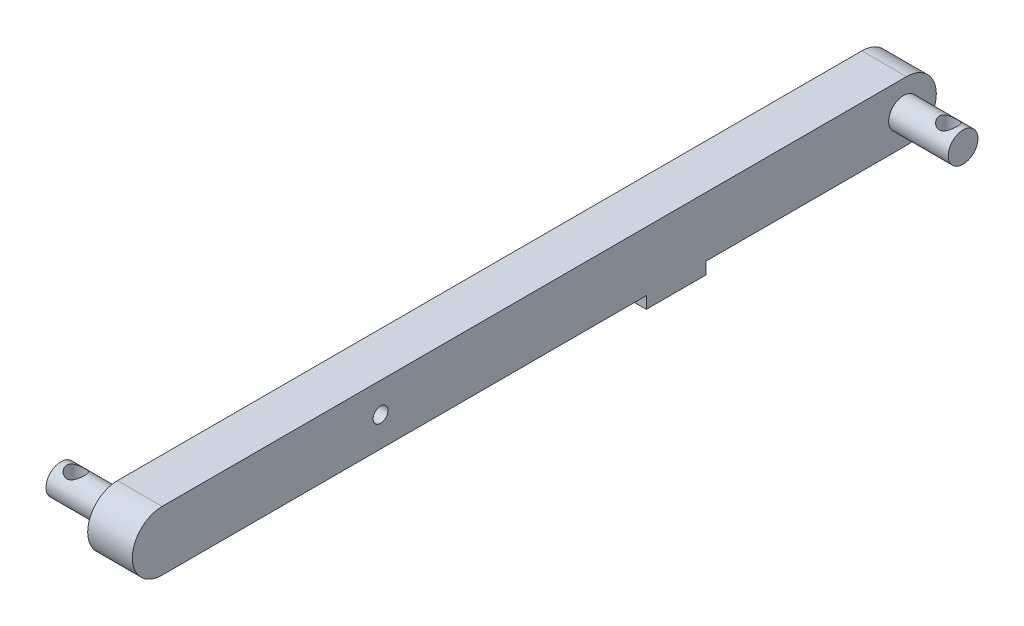
from build123d import *

# Parameters (mm, degrees)
BOSS_EXTRUDE1_DEPTH = 9.525
SKETCH4_R           = 6.35
BOSS_EXTRUDE2_DEPTH = 25.4
SKETCH5_R           = 6.35
BOSS_EXTRUDE3_DEPTH = 25.4
SKETCH6_R           = 3.175
CUT_EXTRUDE1_DEPTH  = 19.05
SKETCH7_W           = 19.05
SKETCH7_H           = 25.4
BOSS_EXTRUDE4_DEPTH = 5.08
SKETCH8_R           = 3.81
CUT_EXTRUDE2_DEPTH  = 6.35


with BuildPart() as part:
    # Sketch2 → Boss-Extrude1 (new, symmetric)
    with BuildSketch(Plane(origin=(0, 0, 0), x_dir=(0, 0, -1), z_dir=(1, 0, 0))):
        with BuildLine():
            Line((-158.75, 12.7), (158.75, 12.7))
            ThreePointArc((158.75, 12.7), (171.45, 0), (158.75, -12.7))
            Line((158.75, -12.7), (-158.75, -12.7))
            ThreePointArc((-158.75, -12.7), (-171.45, 0), (-158.75, 12.7))
        make_face()
    extrude(amount=BOSS_EXTRUDE1_DEPTH, both=True)

    # Sketch4 → Boss-Extrude2 (add)
    with BuildSketch(Plane.ZY.offset(9.525)):
        with Locations((157.48, 0)):
            Circle(SKETCH4_R)
    extrude(amount=BOSS_EXTRUDE2_DEPTH)

    # Sketch5 → Boss-Extrude3 (add)
    with BuildSketch(Plane(origin=(9.525, 0, 0), x_dir=(0, 0, -1), z_dir=(1, 0, 0))):
        with Locations(Location((157.48, 0, 0), (0, 0, 180))):
            Circle(SKETCH5_R)
    extrude(amount=BOSS_EXTRUDE3_DEPTH)

    # Sketch6 → Cut-Extrude1 (cut)
    with BuildSketch(Plane(origin=(9.525, 0, 0), x_dir=(0, 0, -1), z_dir=(1, 0, 0))):
        with Locations((-65.6082, 0)):
            Circle(SKETCH6_R)
    extrude(amount=-CUT_EXTRUDE1_DEPTH, mode=Mode.SUBTRACT)

    # Sketch7 → Boss-Extrude4 (add)
    with BuildSketch(Plane.XZ.offset(12.7)):
        with Locations((0, -60.452)):
            Rectangle(SKETCH7_W, SKETCH7_H)
    extrude(amount=BOSS_EXTRUDE4_DEPTH)

    # Sketch8 → Cut-Extrude2 (cut, symmetric)
    with BuildSketch(Plane(origin=(0, 0, 0), x_dir=(1, 0, 0), z_dir=(0, 1, 0))):
        with Locations(Location((-28.575, -157.48, 0), (0, 0, 270))):
            Circle(SKETCH8_R)
        with Locations(Location((28.575, 157.48, 0), (0, 0, 270))):
            Circle(SKETCH8_R)
    extrude(amount=CUT_EXTRUDE2_DEPTH, both=True, mode=Mode.SUBTRACT)


solid = part.part
